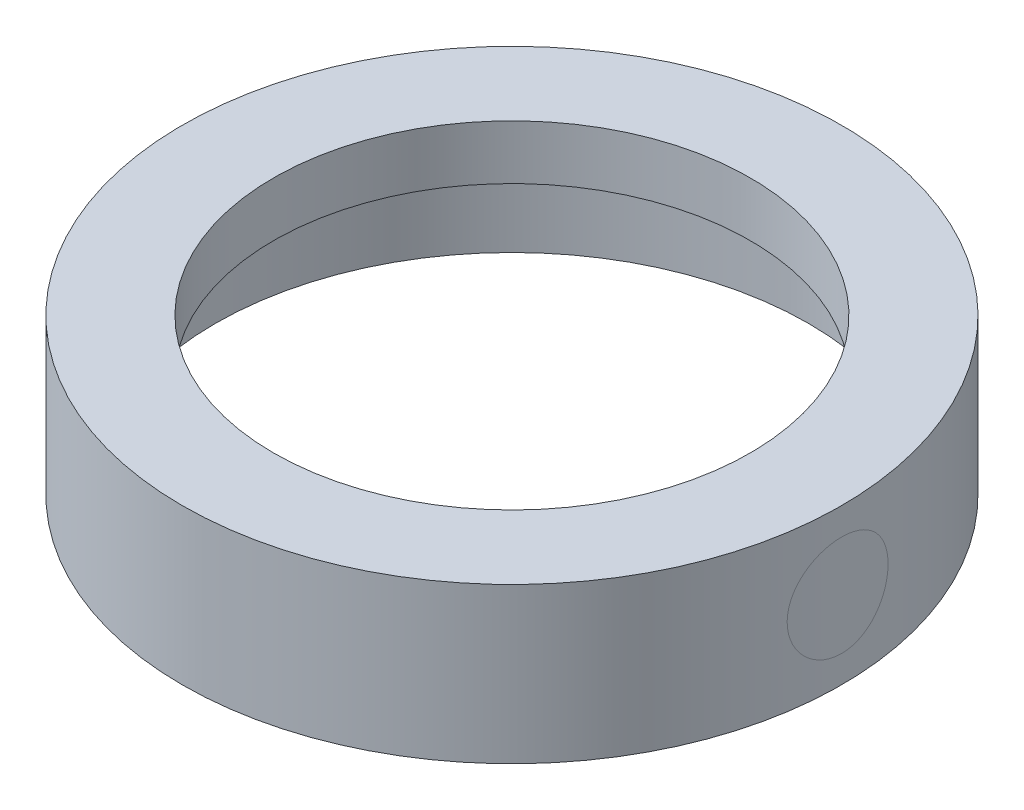
from build123d import *


with BuildPart() as part:
    # Sketch2 → Revolve1 (revolve)
    with BuildSketch(Plane(origin=(0, 0, 0), x_dir=(0, 0, -1), z_dir=(1, 0, 0)), mode=Mode.PRIVATE) as revolve1_sk:
        Polygon((11.1125, 1.08585), (11.1125, 3.6195), (15.367, 3.6195), (15.367, -3.6195), (13.8303, -3.6195), (13.8303, 1.08585), align=None)
    revolve(revolve1_sk.sketch.rotate(Axis((0, 3.98145, 0), (0, -1, 0)), 180), axis=Axis((0, 3.98145, 0), (0, -1, 0)))


solid = part.part
